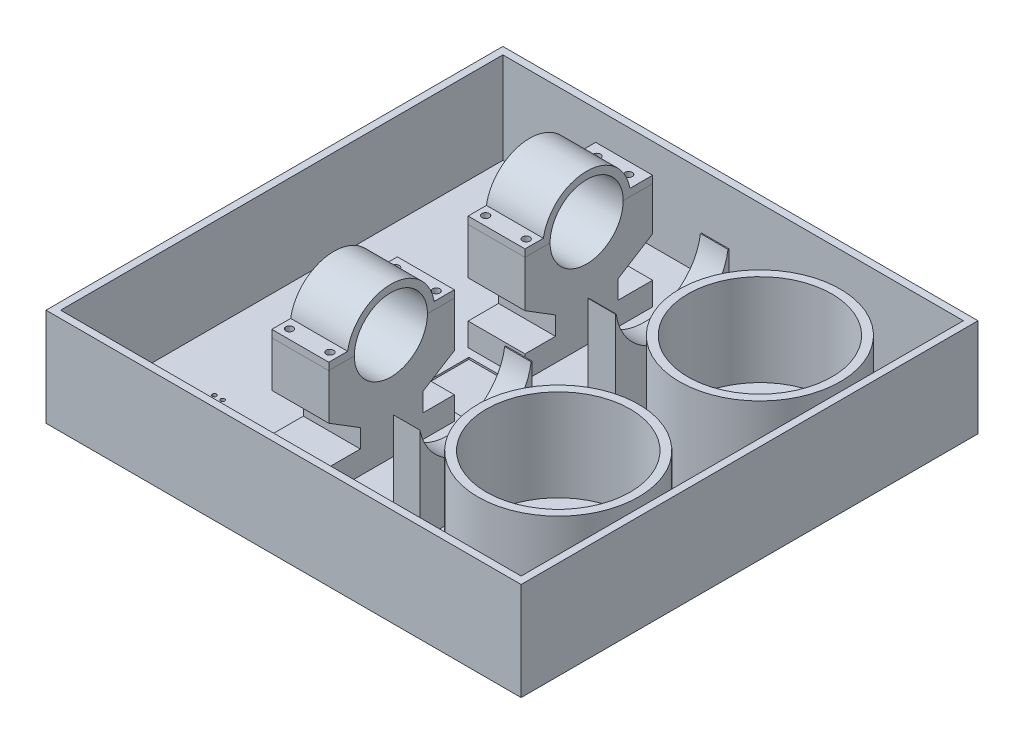
from build123d import *

# Parameters (mm, degrees)
BOSS_EXTRUDE1_DEPTH      = 8
BOSS_EXTRUDE1_DEPTH_BACK = 10
SKETCH2_W                = 1300
SKETCH2_H                = 1250
SKETCH3_W                = 155.828631309
SKETCH3_H                = 343.573970237
SKETCH3_H_2              = 349.206330404
BOSS_EXTRUDE2_DEPTH      = 500
SKETCH5_RX               = 100.015232804
SKETCH5_RY               = 100
CUT_EXTRUDE1_DEPTH       = 155.82863131
CUT_EXTRUDE2_DEPTH       = 572.085684
SKETCH7_R                = 10
CUT_EXTRUDE3_DEPTH       = 60
SKETCH8_W                = 75.439515369
SKETCH8_H                = 310.178932451
SKETCH8_W_2              = 72.492329503
SKETCH8_H_2              = 307.127032147
BOSS_EXTRUDE4_DEPTH      = 271
SKETCH12_R               = 154.407544807
SKETCH12_R_2             = 154.478103023
CUT_EXTRUDE9_DEPTH       = 132.492329504
SKETCH13_R               = 219.774155382
SKETCH13_RX              = 196.899536771
SKETCH13_RY              = 196.889033448
SKETCH13_R_2             = 196.899536771
BOSS_EXTRUDE5_DEPTH      = 271
SKETCH13_3_R             = 196.899536771
SKETCH13_3_RX            = 196.899536771
SKETCH13_3_RY            = 196.889033448
BOSS_EXTRUDE6_DEPTH      = 20
SKETCH14_W               = 450
SKETCH14_H               = 150
CUT_EXTRUDE10_DEPTH      = 5
SKETCH15_R               = 5.57
CUT_EXTRUDE11_DEPTH      = 10
BOSS_EXTRUDE7_DEPTH      = 250
SKETCH17_W               = 20
SKETCH17_H               = 1250
EXTRUDE_THIN1_DEPTH      = 250


with BuildPart() as part:
    # Sketch2 → Boss-Extrude1 (new, two sides: drawn at the far end of the back side and taken through both)
    with BuildSketch(Plane(origin=(0, -430, 0), x_dir=(1, 0, 0), z_dir=(0, 1, 0)).offset(-BOSS_EXTRUDE1_DEPTH_BACK)):
        with Locations((54.399667527, -306.740774081)):
            Rectangle(SKETCH2_W, SKETCH2_H)
    extrude(amount=BOSS_EXTRUDE1_DEPTH + BOSS_EXTRUDE1_DEPTH_BACK)

    # Sketch3 → Boss-Extrude2 (add)
    with BuildSketch(Plane(origin=(0, -422, 0), x_dir=(1, 0, 0), z_dir=(0, 1, 0))):
        with Locations((-101.428963783, -558.403752823)):
            Rectangle(SKETCH3_W, SKETCH3_H)
        with Locations((-101.428963783, -18.635903407)):
            Rectangle(SKETCH3_W, SKETCH3_H_2)
    extrude(amount=BOSS_EXTRUDE2_DEPTH)

    # Sketch5 → Cut-Extrude1 (cut)
    with BuildSketch(Plane(origin=(-23.514648128, 0, 0), x_dir=(0, 0, -1), z_dir=(1, 0, 0))):
        with BuildLine():
            Line((-730.190737941, 78), (-730.190737941, -110.041832689))
            Line((-730.190737941, -110.041832689), (-678.546181173, -110.041832689))
            add(Edge.make_bspline(
                [(-441.872885082, -110.041832689), (-442.064417681, -108.908991965), (-442.978911373, -103.936003535), (-444.207934268, -99.016975736), (-445.920597769, -93.364531922), (-446.540350142, -91.486497595), (-447.874929201, -87.75640614), (-448.585623159, -85.915552712), (-450.845223769, -80.464067462), (-454.197464504, -73.384613871), (-458.215409334, -66.676203343), (-461.480814187, -61.785322555), (-462.611347213, -60.178474557), (-464.371228294, -57.803919648), (-464.968540586, -57.018356985), (-466.184762296, -55.459269233), (-466.804526027, -54.684730112), (-469.94287637, -50.860680553), (-472.584692526, -47.949464159), (-478.122216604, -42.413618724), (-481.017946711, -39.789014725), (-487.062485552, -34.825476227), (-490.211280744, -32.486526442), (-494.309518226, -29.74597604), (-495.137296796, -29.207044134), (-496.809296426, -28.147740236), (-497.653586895, -27.627379189), (-500.19695372, -26.10286781), (-501.911198522, -25.132244251), (-507.108880173, -22.354945502), (-514.185388108, -19.010101586), (-521.549800069, -16.370366704), (-527.182466464, -14.658394057), (-529.078280366, -14.132453457), (-532.907064593, -13.171572472), (-534.844802703, -12.735856475), (-540.655854341, -11.579398304), (-544.53977548, -11.004766119), (-552.326831611, -10.237068967), (-556.229967927, -10.044030329), (-564.055462066, -10.039672277), (-567.977818512, -10.228325532), (-573.876194988, -10.806048359), (-575.847244429, -11.048481384), (-579.751135728, -11.62681459), (-581.689177621, -11.96308019), (-587.462299011, -13.110779095), (-595.05064206, -15.01079736), (-602.423351802, -17.641273842), (-607.870679651, -19.89259895), (-609.672730449, -20.689534627), (-612.354818543, -21.956035379), (-613.246518353, -22.390665545), (-615.014364771, -23.279599163), (-615.891046022, -23.734115415), (-620.238634896, -26.056399367), (-623.602356335, -28.072906061), (-630.106746577, -32.415442786), (-633.247403991, -34.741488621), (-639.30477643, -39.704338307), (-642.221511586, -42.341114225), (-645.722798593, -45.837785449), (-646.415810656, -46.547248066), (-647.779581177, -47.978352007), (-648.451334159, -48.700969776), (-650.436511395, -50.889800727), (-651.7198727, -52.376978466), (-655.451504564, -56.921114858), (-657.781601735, -60.060482357), (-662.129207782, -66.557202479), (-664.146725271, -69.914549096), (-666.933809192, -75.117371064), (-667.822900576, -76.879495048), (-669.519501894, -80.460634279), (-670.321018826, -82.267163151), (-672.582848798, -87.722236204), (-673.903154639, -91.411177185), (-676.176529821, -98.891303888), (-677.129586868, -102.682493033), (-678.130975214, -107.692628269), (-678.347207722, -108.864827875), (-678.546181173, -110.041832689)],
                knots=[0.026655338, 0.026655338, 0.026655338, 0.026655338, 0.03125, 0.046875, 0.046875, 0.0546875, 0.0546875, 0.0625, 0.0625, 0.078125, 0.09375, 0.09375, 0.1015625, 0.1015625, 0.10546875, 0.10546875, 0.109375, 0.109375, 0.125, 0.125, 0.140625, 0.140625, 0.15625, 0.15625, 0.16015625, 0.16015625, 0.1640625, 0.1640625, 0.171875, 0.171875, 0.1875, 0.203125, 0.203125, 0.2109375, 0.2109375, 0.21875, 0.21875, 0.234375, 0.234375, 0.25, 0.25, 0.265625, 0.265625, 0.2734375, 0.2734375, 0.28125, 0.28125, 0.296875, 0.3125, 0.3125, 0.3203125, 0.3203125, 0.32421875, 0.32421875, 0.328125, 0.328125, 0.34375, 0.34375, 0.359375, 0.359375, 0.375, 0.375, 0.37890625, 0.37890625, 0.3828125, 0.3828125, 0.390625, 0.390625, 0.40625, 0.40625, 0.421875, 0.421875, 0.4296875, 0.4296875, 0.4375, 0.4375, 0.453125, 0.453125, 0.46875, 0.46875, 0.473496978, 0.473496978, 0.473496978, 0.473496978], degree=3))
            Line((-441.872885082, -110.041832689), (-386.616767704, -110.041832689))
            Line((-386.616767704, -110.041832689), (-386.616767704, 78))
            Line((-386.616767704, 78), (-730.190737941, 78))
        make_face()
        with BuildLine():
            Line((93.708319741, -110.041832689), (155.967261795, -110.041832689))
            Line((155.967261795, -110.041832689), (155.967261795, 78))
            Line((155.967261795, 78), (-193.239068609, 78))
            Line((-193.239068609, 78), (-193.239068609, -110.041832689))
            Line((-193.239068609, -110.041832689), (-142.964976351, -110.041832689))
            add(Edge.make_bspline(
                [(93.708319741, -110.041832689), (93.516787142, -108.908991965), (92.602293449, -103.936003535), (91.373270555, -99.016975736), (89.660607054, -93.364531922), (89.04085468, -91.486497595), (87.706275622, -87.75640614), (86.995581663, -85.915552712), (84.735981053, -80.464067462), (81.383740319, -73.384613871), (77.365795489, -66.676203343), (74.100390636, -61.785322555), (72.96985761, -60.178474557), (71.209976528, -57.803919648), (70.612664236, -57.018356985), (69.396442526, -55.459269233), (68.776678795, -54.684730112), (65.638328452, -50.860680553), (62.996512297, -47.949464159), (57.458988219, -42.413618724), (54.563258111, -39.789014725), (48.518719271, -34.825476227), (45.369924079, -32.486526442), (41.271686597, -29.74597604), (40.443908026, -29.207044134), (38.771908397, -28.147740236), (37.927617928, -27.627379189), (35.384251102, -26.10286781), (33.6700063, -25.132244251), (28.47232465, -22.354945502), (21.395816714, -19.010101586), (14.031404753, -16.370366704), (8.398738359, -14.658394057), (6.502924456, -14.132453457), (2.67414023, -13.171572472), (0.736402119, -12.735856475), (-5.074649518, -11.579398304), (-8.958570658, -11.004766119), (-16.745626788, -10.237068967), (-20.648763105, -10.044030329), (-28.474257244, -10.039672277), (-32.396613689, -10.228325532), (-38.294990165, -10.806048359), (-40.266039607, -11.048481384), (-44.169930905, -11.62681459), (-46.107972798, -11.96308019), (-51.881094188, -13.110779095), (-59.469437238, -15.01079736), (-66.842146979, -17.641273842), (-72.289474828, -19.89259895), (-74.091525626, -20.689534627), (-76.773613721, -21.956035379), (-77.665313531, -22.390665545), (-79.433159948, -23.279599163), (-80.3098412, -23.734115415), (-84.657430074, -26.056399367), (-88.021151513, -28.072906061), (-94.525541754, -32.415442786), (-97.666199168, -34.741488621), (-103.723571608, -39.704338307), (-106.640306764, -42.341114225), (-110.14159377, -45.837785449), (-110.834605833, -46.547248066), (-112.198376355, -47.978352007), (-112.870129337, -48.700969776), (-114.855306572, -50.889800727), (-116.138667877, -52.376978466), (-119.870299742, -56.921114858), (-122.200396912, -60.060482357), (-126.548002959, -66.557202479), (-128.565520449, -69.914549096), (-131.35260437, -75.117371064), (-132.241695754, -76.879495048), (-133.938297071, -80.460634279), (-134.739814004, -82.267163151), (-137.001643976, -87.722236204), (-138.321949816, -91.411177185), (-140.595324998, -98.891303888), (-141.548382046, -102.682493033), (-142.549770391, -107.692628269), (-142.7660029, -108.864827875), (-142.964976351, -110.041832689)],
                knots=[0.026655338, 0.026655338, 0.026655338, 0.026655338, 0.03125, 0.046875, 0.046875, 0.0546875, 0.0546875, 0.0625, 0.0625, 0.078125, 0.09375, 0.09375, 0.1015625, 0.1015625, 0.10546875, 0.10546875, 0.109375, 0.109375, 0.125, 0.125, 0.140625, 0.140625, 0.15625, 0.15625, 0.16015625, 0.16015625, 0.1640625, 0.1640625, 0.171875, 0.171875, 0.1875, 0.203125, 0.203125, 0.2109375, 0.2109375, 0.21875, 0.21875, 0.234375, 0.234375, 0.25, 0.25, 0.265625, 0.265625, 0.2734375, 0.2734375, 0.28125, 0.28125, 0.296875, 0.3125, 0.3125, 0.3203125, 0.3203125, 0.32421875, 0.32421875, 0.328125, 0.328125, 0.34375, 0.34375, 0.359375, 0.359375, 0.375, 0.375, 0.37890625, 0.37890625, 0.3828125, 0.3828125, 0.390625, 0.390625, 0.40625, 0.40625, 0.421875, 0.421875, 0.4296875, 0.4296875, 0.4375, 0.4375, 0.453125, 0.453125, 0.46875, 0.46875, 0.473496978, 0.473496978, 0.473496978, 0.473496978], degree=3))
        make_face()
        with Locations(Location((-560.209560481, -130.041832689), (0, 0, 180))):
            Ellipse(SKETCH5_RX, SKETCH5_RY)
        with Locations(Location((-24.628355658, -130.041832689), (0, 0, 180))):
            Ellipse(SKETCH5_RX, SKETCH5_RY)
    extrude(amount=-CUT_EXTRUDE1_DEPTH, mode=Mode.SUBTRACT)

    # Sketch5<3> → Cut-Extrude2 (cut)
    with BuildSketch(Plane(origin=(-23.514648128, 0, 0), x_dir=(0, 0, -1), z_dir=(1, 0, 0))):
        Polygon((-643.87449611, -308.212265463), (-730.190737941, -254.602089592), (-730.190737941, -358.844098231), (-643.87449611, -358.844098231), align=None)
        Polygon((-386.616767704, -358.844098231), (-386.616767704, -254.602089592), (-472.933009536, -308.212265463), (-472.933009536, -358.844098231), align=None)
        Polygon((-109.941448076, -308.212265463), (-193.239068609, -256.476925837), (-193.239068609, -358.844098231), (-109.941448076, -358.844098231), align=None)
        Polygon((155.967261795, -358.844098231), (155.967261795, -248.705927181), (61.000038498, -308.212265463), (61.000038498, -358.844098231), align=None)
    extrude(amount=-CUT_EXTRUDE2_DEPTH, mode=Mode.SUBTRACT)

    # Sketch7 → Cut-Extrude3 (cut)
    with BuildSketch(Plane(origin=(0, -110.041832689, 0), x_dir=(1, 0, 0), z_dir=(0, 1, 0))):
        with Locations(Location((-144.653249835, 124.837790768, 0), (0, 0, 270))):
            Circle(SKETCH7_R)
        with Locations(Location((-58.123986534, 124.837790768, 0), (0, 0, 270))):
            Circle(SKETCH7_R)
        with Locations(Location((-156.242817386, -168.10202248, 0), (0, 0, 270))):
            Circle(SKETCH7_R)
        with Locations(Location((-45.557062854, -168.10202248, 0), (0, 0, 270))):
            Circle(SKETCH7_R)
        with Locations(Location((-156.242817386, -414.244826393, 0), (0, 0, 270))):
            Circle(SKETCH7_R)
        with Locations(Location((-45.557062854, -414.244826393, 0), (0, 0, 270))):
            Circle(SKETCH7_R)
        with Locations(Location((-156.242817386, -704.999918003, 0), (0, 0, 270))):
            Circle(SKETCH7_R)
        with Locations(Location((-45.557062854, -704.999918003, 0), (0, 0, 270))):
            Circle(SKETCH7_R)
    extrude(amount=-CUT_EXTRUDE3_DEPTH, mode=Mode.SUBTRACT)

    # Sketch8 → Boss-Extrude4 (add)
    with BuildSketch(Plane(origin=(0, -422, 0), x_dir=(1, 0, 0), z_dir=(0, 1, 0))):
        with Locations((176.741671202, -28.123842715)):
            Rectangle(SKETCH8_W, SKETCH8_H)
        with Locations((175.268078269, -562.179097384)):
            Rectangle(SKETCH8_W_2, SKETCH8_H_2)
    extrude(amount=BOSS_EXTRUDE4_DEPTH)

    # Sketch12 → Cut-Extrude9 (cut)
    with BuildSketch(Plane(origin=(271.51424302, 0, 0), x_dir=(0, 0, -1), z_dir=(1, 0, 0))):
        with Locations((-564.410485973, -130.041832689)):
            Circle(SKETCH12_R)
        with Locations((-28.82928115, -130.041832689)):
            Circle(SKETCH12_R_2)
    extrude(amount=-CUT_EXTRUDE9_DEPTH, mode=Mode.SUBTRACT)

    # Sketch13 → Boss-Extrude5 (add)
    # profile 1 of 2: a face of its own
    with BuildSketch(Plane(origin=(0, -422, 0), x_dir=(1, 0, 0), z_dir=(0, 1, 0))):
        with Locations(Location((461.821893789, -35.901466828, 0), (0, 0, 270))):
            Circle(SKETCH13_R)
        with Locations(Location((461.821893789, -35.901466828), (0, 0, -115.624189284))):
            Ellipse(SKETCH13_RX, SKETCH13_RY, mode=Mode.SUBTRACT)
    # profile 2 of 2: a face of its own
    with BuildSketch(Plane(origin=(0, -422, 0), x_dir=(1, 0, 0), z_dir=(0, 1, 0))):
        with Locations(Location((458.94405024, -584.692101713, 0), (0, 0, 270))):
            Circle(SKETCH13_R)
        with Locations(Location((458.94405024, -584.692101713, 0), (0, 0, 270))):
            Circle(SKETCH13_R_2, mode=Mode.SUBTRACT)
    extrude(amount=BOSS_EXTRUDE5_DEPTH)

    # Sketch13<3> → Boss-Extrude6 (add)
    with BuildSketch(Plane(origin=(0, -422, 0), x_dir=(1, 0, 0), z_dir=(0, 1, 0))):
        with Locations(Location((458.94405024, -584.692101713, 0), (0, 0, 270))):
            Circle(SKETCH13_3_R)
        with Locations(Location((461.821893789, -35.901466828), (0, 0, -115.624189284))):
            Ellipse(SKETCH13_3_RX, SKETCH13_3_RY)
    extrude(amount=BOSS_EXTRUDE6_DEPTH)

    # Sketch14 → Cut-Extrude10 (cut)
    with BuildSketch(Plane(origin=(0, -422, 0), x_dir=(1, 0, 0), z_dir=(0, 1, 0))):
        with Locations((69.399667527, -289.700774081)):
            Rectangle(SKETCH14_W, SKETCH14_H)
    extrude(amount=-CUT_EXTRUDE10_DEPTH, mode=Mode.SUBTRACT)

    # Sketch15 → Cut-Extrude11 (cut)
    with BuildSketch(Plane(origin=(0, -422, 0), x_dir=(1, 0, 0), z_dir=(0, 1, 0))):
        with Locations(Location((-413.600332473, 178.259225919, 0), (0, 0, 270))):
            Circle(SKETCH15_R)
        with Locations(Location((-391.100332473, 178.259225919, 0), (0, 0, 270))):
            Circle(SKETCH15_R)
        with Locations(Location((-413.600332473, 61.269225919, 0), (0, 0, 270))):
            Circle(SKETCH15_R)
        with Locations(Location((-391.100332473, 61.269225919, 0), (0, 0, 270))):
            Circle(SKETCH15_R)
        with Locations(Location((-413.600332473, -769.790774081, 0), (0, 0, 270))):
            Circle(SKETCH15_R)
        with Locations(Location((-413.600332473, -652.800774081, 0), (0, 0, 270))):
            Circle(SKETCH15_R)
        with Locations(Location((-391.100332473, -652.800774081, 0), (0, 0, 270))):
            Circle(SKETCH15_R)
        with Locations(Location((-391.100332473, -769.790774081, 0), (0, 0, 270))):
            Circle(SKETCH15_R)
    extrude(amount=-CUT_EXTRUDE11_DEPTH, mode=Mode.SUBTRACT)

    # Sketch16 → Boss-Extrude7 (add)
    with BuildSketch(Plane(origin=(0, -422, 0), x_dir=(1, 0, 0), z_dir=(0, 1, 0))):
        Polygon((-575.600332473, -911.740774081), (-575.600332473, 298.259225919), (704.399667527, 298.259225919), (704.399667527, 318.259225919), (-595.600332473, 318.259225919), (-595.600332473, -931.740774081), (704.399667527, -931.740774081), (704.399667527, -911.740774081), align=None)
    extrude(amount=BOSS_EXTRUDE7_DEPTH)

    # Sketch17 → Extrude-Thin1 (add)
    with BuildSketch(Plane(origin=(0, -422, 0), x_dir=(1, 0, 0), z_dir=(0, 1, 0))):
        with Locations((694.399667527, -306.740774081)):
            Rectangle(SKETCH17_W, SKETCH17_H)
    extrude(amount=EXTRUDE_THIN1_DEPTH)


solid = part.part
